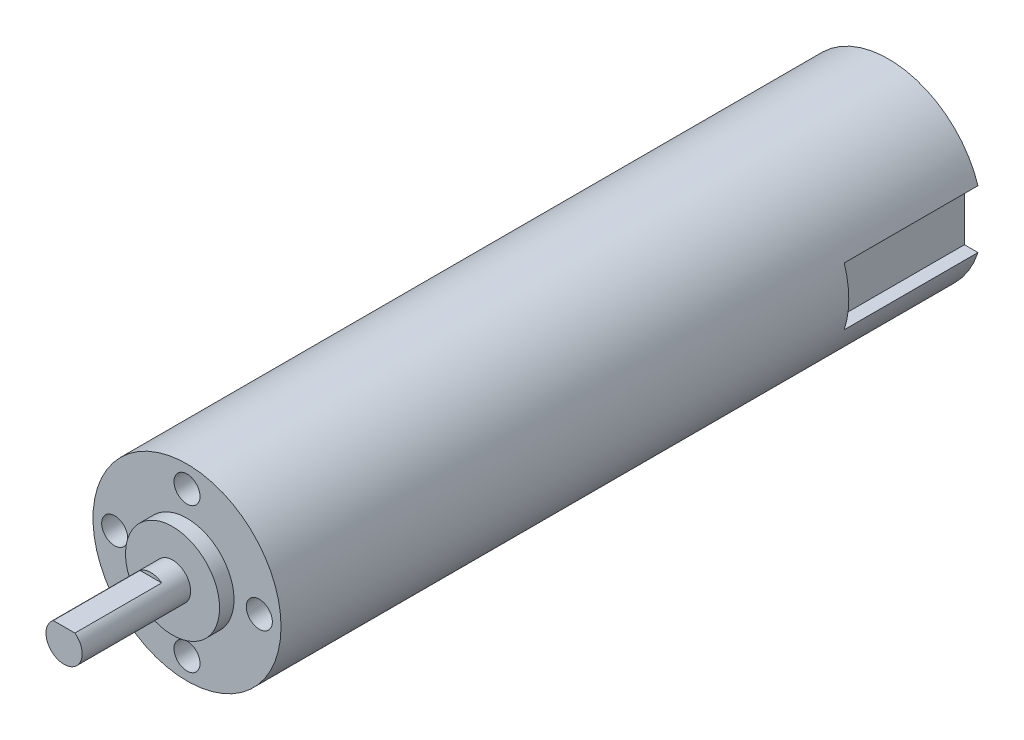
from build123d import *

# Parameters (mm, degrees)
ESQUISSE1_R             = 13
BOSS_EXTRU_1_DEPTH      = 97
ESQUISSE2_R             = 2.5
BOSS_EXTRU_2_DEPTH      = 17
ENL_V_MAT_EXTRU_1_DEPTH = 18.5
ESQUISSE4_R             = 6.5
ESQUISSE4_R_2           = 2.5
BOSS_EXTRU_3_DEPTH      = 2
ESQUISSE5_R             = 1.8
ENL_V_MAT_EXTRU_2_DEPTH = 4
ENL_V_START             = -12
ENL_V_MAT_EXTRU_3_DEPTH = 12
ESQUISSE7_R             = 2.496805343
BOSS_EXTRU_4_DEPTH      = 3


with BuildPart() as part:
    # Esquisse1 → Boss.-Extru.1 (new body)
    with BuildSketch(Plane.XY):
        with Locations(Location((0, 0, 0), (0, 0, 180))):
            Circle(ESQUISSE1_R)
    extrude(amount=BOSS_EXTRU_1_DEPTH)

    # Esquisse2 → Boss.-Extru.2 (add)
    with BuildSketch(Plane.XY.offset(97)):
        Circle(ESQUISSE2_R)
    extrude(amount=BOSS_EXTRU_2_DEPTH)

    # Esquisse3 → Enlèv. mat.-Extru.1 (cut)
    with BuildSketch(Plane(origin=(0, 0, 0), x_dir=(-1, 0, 0), z_dir=(0, 0, -1))):
        with BuildLine():
            Line((-10.5, 0), (-10.5, 4))
            Line((-10.5, 4), (-12.369316877, 4))
            ThreePointArc((-12.369316877, 4), (-13, 0), (-12.369316877, -4))
            Line((-12.369316877, -4), (-10.5, -4))
            Line((-10.5, -4), (-10.5, 0))
        make_face()
        with BuildLine():
            Line((10.5, 0), (10.5, 4))
            Line((10.5, 4), (12.369316877, 4))
            ThreePointArc((12.369316877, 4), (12.99999812, -0.006990598), (12.365007817, -4.013300596))
            Line((12.365007817, -4.013300596), (10.5, -4))
            Line((10.5, -4), (10.5, 0))
        make_face()
    extrude(amount=-ENL_V_MAT_EXTRU_1_DEPTH, mode=Mode.SUBTRACT)

    # Esquisse4 → Boss.-Extru.3 (add)
    with BuildSketch(Plane.XY.offset(97)):
        Circle(ESQUISSE4_R)
        Circle(ESQUISSE4_R_2, mode=Mode.SUBTRACT)
    extrude(amount=BOSS_EXTRU_3_DEPTH)

    # Esquisse5 → Enlèv. mat.-Extru.2 (cut)
    with BuildSketch(Plane.XY.offset(97)):
        with Locations((0, 10)):
            Circle(ESQUISSE5_R)
        with Locations((-10, 0)):
            Circle(ESQUISSE5_R)
        with Locations((0, -10)):
            Circle(ESQUISSE5_R)
        with Locations((10, 0)):
            Circle(ESQUISSE5_R)
    extrude(amount=-ENL_V_MAT_EXTRU_2_DEPTH, mode=Mode.SUBTRACT)

    # Esquisse6 → Enlèv. mat.-Extru.3 (cut)
    with BuildSketch(Plane.XY.offset(114).offset(ENL_V_START)):
        with BuildLine():
            Line((0, 2), (1.5, 2))
            ThreePointArc((1.5, 2), (0, 2.5), (-1.5, 2))
            Line((-1.5, 2), (0, 2))
        make_face()
    extrude(amount=ENL_V_MAT_EXTRU_3_DEPTH, mode=Mode.SUBTRACT)


with BuildPart() as body_2:
    # Esquisse7 → Boss.-Extru.4 (new body)
    with BuildSketch(Plane.XY.offset(97)):
        Circle(ESQUISSE7_R)
    extrude(amount=BOSS_EXTRU_4_DEPTH)


solid = Compound([part.part, body_2.part])
